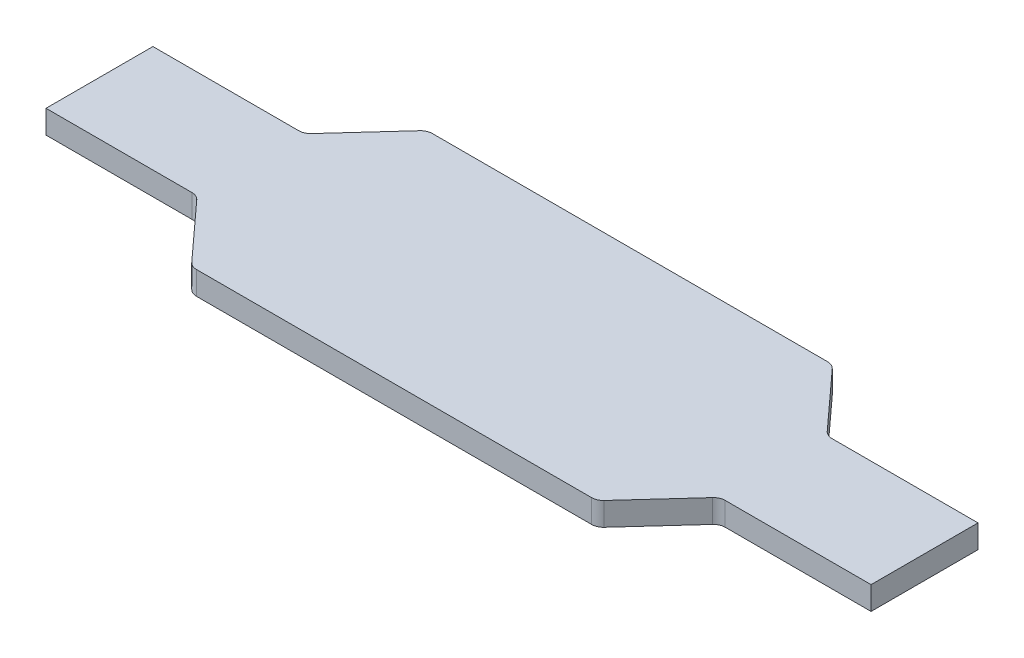
from build123d import *

# Parameters (mm, degrees)
BOSS_EXTRUDE1_DEPTH = 10


with BuildPart() as part:
    # Sketch1 → Boss-Extrude1 (new body)
    with BuildSketch(Plane(origin=(0, 0, 0), x_dir=(1, 0, 0), z_dir=(0, 1, 0))):
        with BuildLine():
            Line((-130.308370044, 61.40969163), (39.691629956, 61.40969163))
            ThreePointArc((39.691629956, 61.40969163), (41.71129335, 60.983635199), (43.386760513, 59.77807554))
            Line((43.386760513, 59.77807554), (65.66049007, 35.343705551))
            ThreePointArc((65.66049007, 35.343705551), (67.335957233, 34.138145891), (69.355620627, 33.712089461))
            Line((69.355620627, 33.712089461), (132.147828419, 33.712089461))
            Line((132.147828419, 33.712089461), (132.147828419, -12.287910539))
            Line((132.147828419, -12.287910539), (69.355620627, -12.287910539))
            ThreePointArc((69.355620627, -12.287910539), (67.335957233, -12.71396697), (65.66049007, -13.91952663))
            Line((65.66049007, -13.91952663), (43.386760513, -38.353896619))
            ThreePointArc((43.386760513, -38.353896619), (41.71129335, -39.559456278), (39.691629956, -39.985512709))
            Line((39.691629956, -39.985512709), (-130.308370044, -39.985512709))
            ThreePointArc((-130.308370044, -39.985512709), (-132.328033438, -39.559456278), (-134.003500602, -38.353896619))
            Line((-134.003500602, -38.353896619), (-156.277230158, -13.91952663))
            ThreePointArc((-156.277230158, -13.91952663), (-157.952697321, -12.71396697), (-159.972360715, -12.287910539))
            Line((-159.972360715, -12.287910539), (-222.764568508, -12.287910539))
            Line((-222.764568508, -12.287910539), (-222.764568508, 33.712089461))
            Line((-222.764568508, 33.712089461), (-159.972360715, 33.712089461))
            ThreePointArc((-159.972360715, 33.712089461), (-157.952697321, 34.138145891), (-156.277230158, 35.343705551))
            Line((-156.277230158, 35.343705551), (-134.003500602, 59.77807554))
            ThreePointArc((-134.003500602, 59.77807554), (-132.328033438, 60.983635199), (-130.308370044, 61.40969163))
        make_face()
    extrude(amount=BOSS_EXTRUDE1_DEPTH)


solid = part.part
